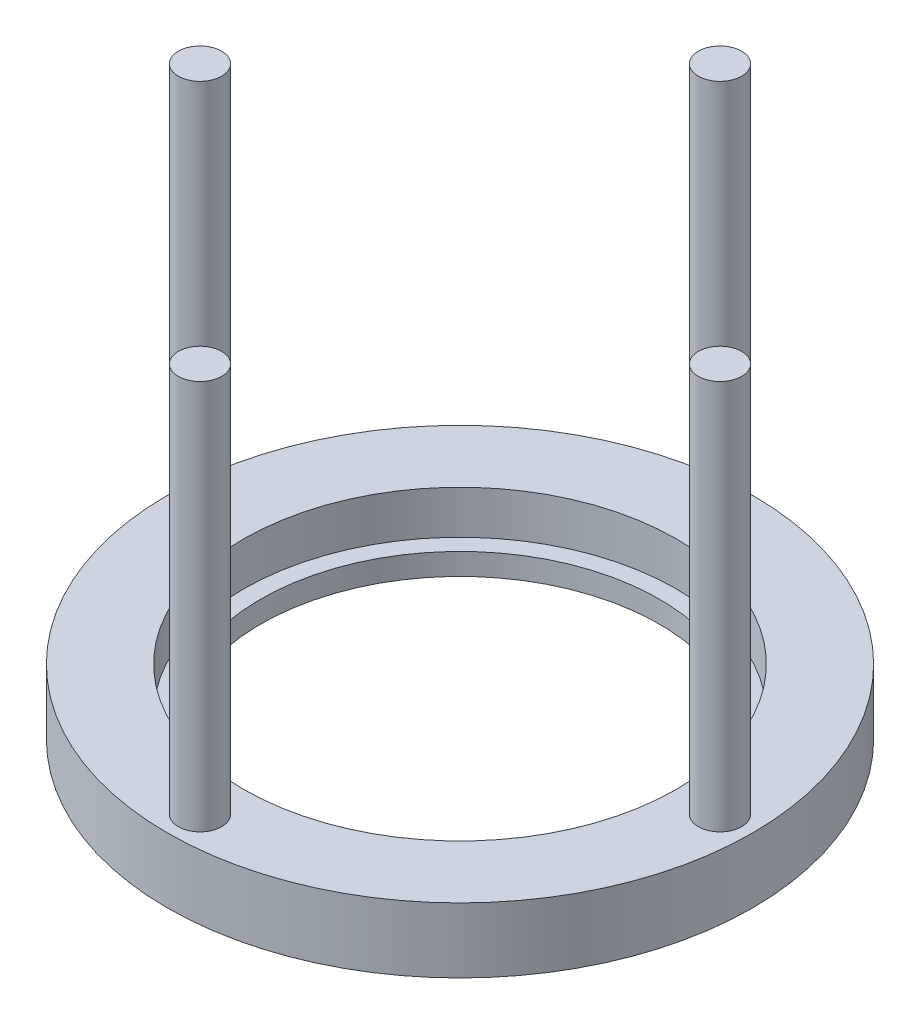
from build123d import *

# Parameters (mm, degrees)
SKETCH1_R           = 33.75
BOSS_EXTRUDE1_DEPTH = 7.5
SKETCH2_R           = 2.5
BOSS_EXTRUDE2_DEPTH = 45
SKETCH3_R           = 25
CUT_EXTRUDE1_DEPTH  = 5
SKETCH4_R           = 23
CUT_EXTRUDE2_DEPTH  = 70.123982813


with BuildPart() as part:
    # Sketch1 → Boss-Extrude1 (new body)
    with BuildSketch(Plane(origin=(0, 0, 0), x_dir=(1, 0, 0), z_dir=(0, 1, 0))):
        with Locations(Location((0, 0, 0), (0, 0, 270))):
            Circle(SKETCH1_R)
    extrude(amount=BOSS_EXTRUDE1_DEPTH)

    # Sketch2 → Boss-Extrude2 (add)
    with BuildSketch(Plane(origin=(0, 7.5, 0), x_dir=(1, 0, 0), z_dir=(0, 1, 0))):
        with Locations(Location((-30, 0, 0), (0, 0, 90))):
            Circle(SKETCH2_R)
        with Locations(Location((30, 0, 0), (0, 0, 90))):
            Circle(SKETCH2_R)
        with Locations(Location((0, -30, 0), (0, 0, 90))):
            Circle(SKETCH2_R)
        with Locations(Location((0, 30, 0), (0, 0, 90))):
            Circle(SKETCH2_R)
    extrude(amount=BOSS_EXTRUDE2_DEPTH)

    # Sketch3 → Cut-Extrude1 (cut)
    with BuildSketch(Plane(origin=(0, 7.5, 0), x_dir=(1, 0, 0), z_dir=(0, 1, 0))):
        with Locations(Location((0, 0, 0), (0, 0, 270))):
            Circle(SKETCH3_R)
    extrude(amount=-CUT_EXTRUDE1_DEPTH, mode=Mode.SUBTRACT)

    # Sketch4 → Cut-Extrude2 (cut, through all)
    with BuildSketch(Plane(origin=(0, 2.5, 0), x_dir=(1, 0, 0), z_dir=(0, 1, 0))):
        with Locations(Location((0, 0, 0), (0, 0, 270))):
            Circle(SKETCH4_R)
    extrude(amount=-CUT_EXTRUDE2_DEPTH, mode=Mode.SUBTRACT)


solid = part.part
